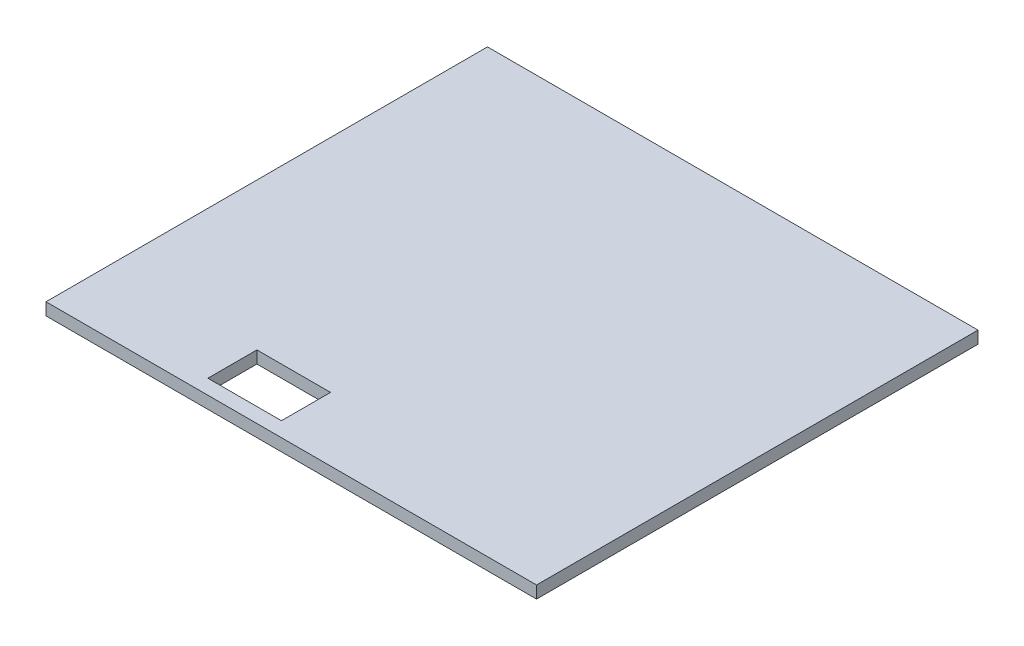
from build123d import *

# Parameters (mm, degrees)
SKETCH1_W           = 100
SKETCH1_H           = 90
SKETCH1_W_2         = 15
SKETCH1_H_2         = 10
BOSS_EXTRUDE1_DEPTH = 2.5


with BuildPart() as part:
    # Sketch1 → Boss-Extrude1 (new body)
    with BuildSketch(Plane(origin=(0, 0, 0), x_dir=(1, 0, 0), z_dir=(0, 1, 0))):
        Rectangle(SKETCH1_W, SKETCH1_H)
        with Locations((-12.5, -37)):
            Rectangle(SKETCH1_W_2, SKETCH1_H_2, mode=Mode.SUBTRACT)
    extrude(amount=BOSS_EXTRUDE1_DEPTH)


solid = part.part
